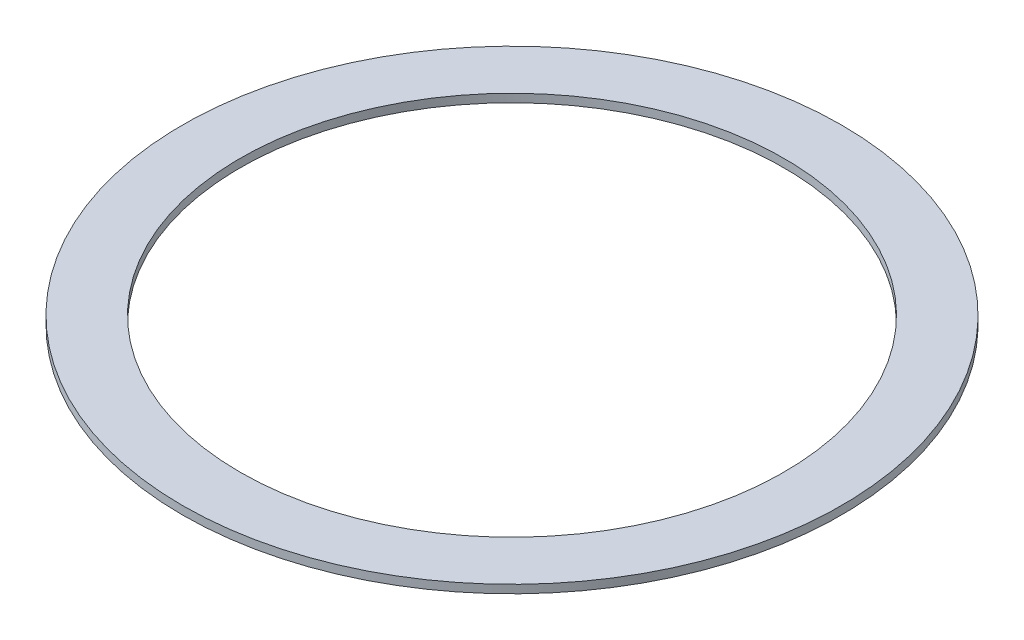
from build123d import *

# Parameters (mm, degrees)
SZKIC1_R                    = 40
SZKIC1_R_2                  = 33
DODANIE_WYCI_GNI_CIE1_DEPTH = 1


with BuildPart() as part:
    # Szkic1 → Dodanie-wyciągnięcie1 (new body)
    with BuildSketch(Plane(origin=(0, 0, 0), x_dir=(1, 0, 0), z_dir=(0, 1, 0))):
        with Locations(Location((0, 0, 0), (0, 0, 270))):
            Circle(SZKIC1_R)
        with Locations(Location((0, 0, 0), (0, 0, 270))):
            Circle(SZKIC1_R_2, mode=Mode.SUBTRACT)
    extrude(amount=DODANIE_WYCI_GNI_CIE1_DEPTH)


solid = part.part
